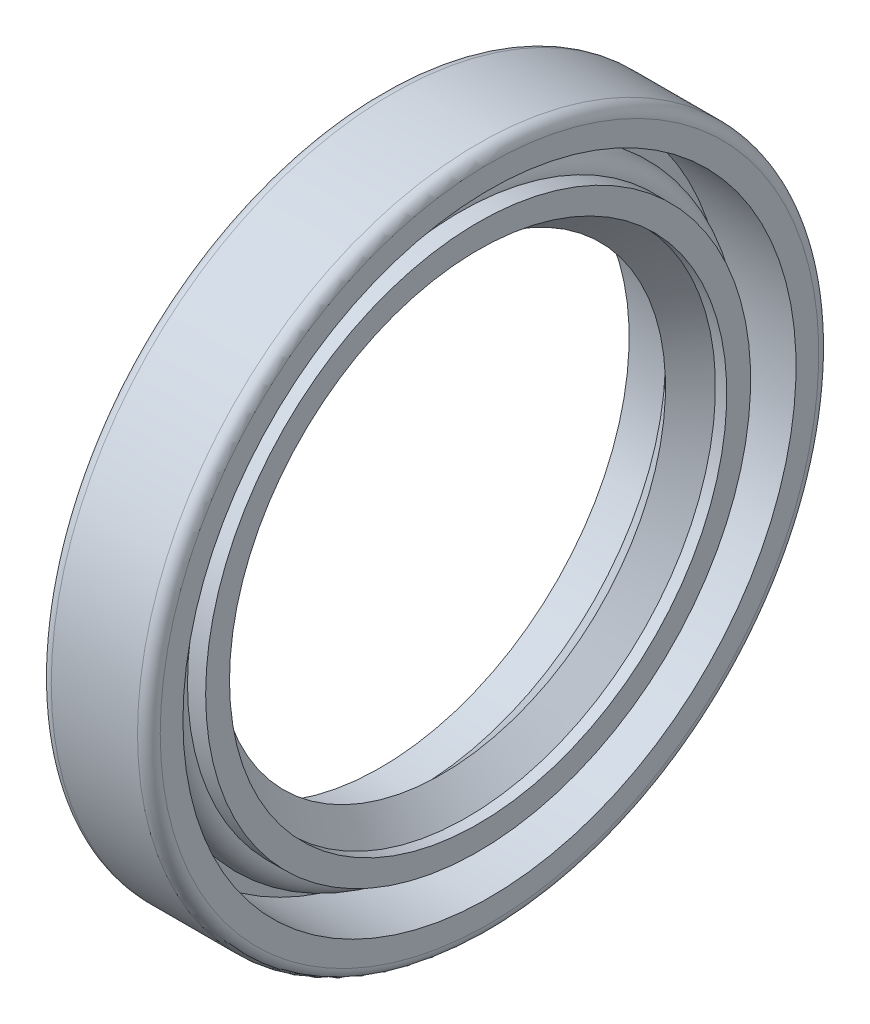
from build123d import *

# Parameters (mm, degrees)
EDGE_FILLET_R = 0.635


with BuildPart() as part:
    # Primary Sketch → Primary Revolve (revolve)
    with BuildSketch(Plane.XY, mode=Mode.PRIVATE) as primary_revolve_sk:
        with BuildLine():
            Line((2.032, 17.145), (6.096, 17.145))
            Line((6.096, 17.145), (6.096, 19.05))
            Line((6.096, 19.05), (0, 19.05))
            Line((0, 19.05), (0, 17.145))
            Line((0, 17.145), (0, 13.9065))
            Line((0, 13.9065), (2.032, 13.9065))
            Line((2.032, 13.9065), (3.429, 12.5095))
            Line((3.429, 12.5095), (4.826, 13.9065))
            Line((4.826, 13.9065), (5.461, 13.9065))
            Line((5.461, 13.9065), (5.461, 15.24))
            Line((5.461, 15.24), (4.445, 15.24))
            ThreePointArc((4.445, 15.24), (3.429, 16.256), (2.413, 15.24))
            Line((2.413, 15.24), (2.032, 15.24))
            Line((2.032, 15.24), (2.032, 17.145))
        make_face()
    revolve(primary_revolve_sk.sketch.rotate(Axis((0, 0, 0), (1, 0, 0)), 90), axis=Axis((0, 0, 0), (1, 0, 0)))

    # Edge Fillet
    edge_fillet_edges = [part.edges().sort_by_distance(p)[0] for p in [
        (6.096, 0, -19.05),
        (0, 0, -19.05),
    ]]
    fillet(edge_fillet_edges, radius=EDGE_FILLET_R)


solid = part.part
